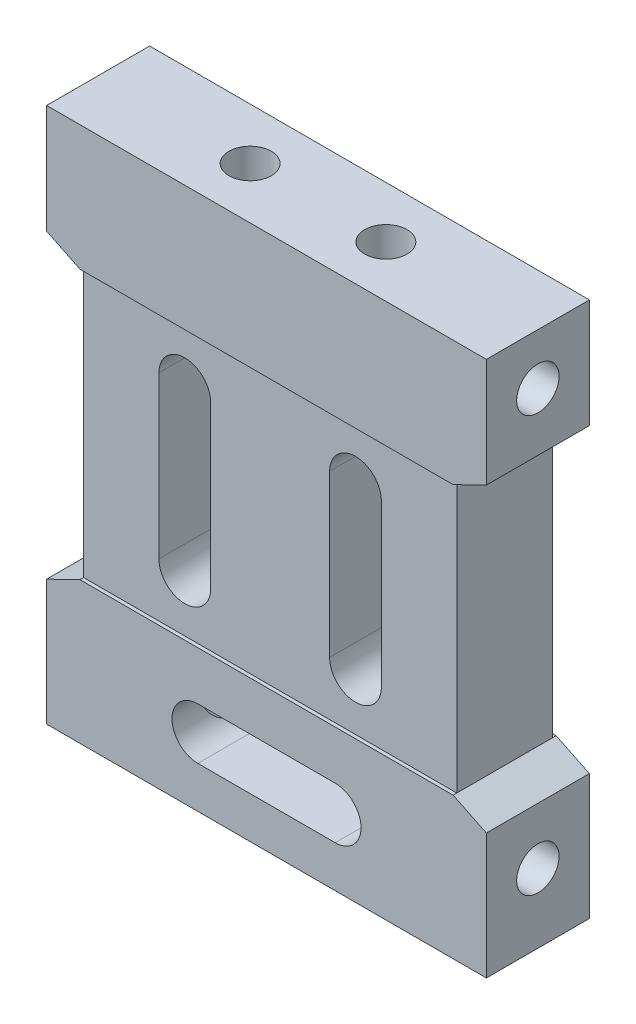
from build123d import *

# Parameters (mm, degrees)
SCHIZZO1_W                         = 25.92
SCHIZZO1_H                         = 31.58
ESTRUSIONE_ESTRUSIONE1_DEPTH       = 6.07
TAGLIO_ESTRUSIONE1_DEPTH           = 22.310340213
SCHIZZO3_W                         = 0.215
SCHIZZO3_H                         = 15.85
TAGLIO_ESTRUSIONE2_DEPTH           = 31.951823856
FORO_FILETTATO_M3X0_5_1_D          = 2.5
FORO_FILETTATO_M3X0_5_1_DEPTH      = 8.5
FORO_FILETTATO_M3X0_5_1_TIP        = 0.751075774
FORO_FILETTATO_M3X0_5_3_AT_2_COUNT = 2
FORO_FILETTATO_M3X0_5_3_AT_2_PITCH = 24.5


with BuildPart() as part:
    # Schizzo1 → Estrusione-Estrusione1 (new body)
    with BuildSketch(Plane.XY):
        Rectangle(SCHIZZO1_W, SCHIZZO1_H)
    extrude(amount=-ESTRUSIONE_ESTRUSIONE1_DEPTH)

    # Schizzo2 → Taglio-Estrusione1 (cut, through all)
    with BuildSketch(Plane.XY):
        Polygon((-11, 8.415), (-12.96, 9.37), (-12.96, -8.39), (-11, -7.435), align=None)
        with BuildLine():
            Line((-6.555, 5.24), (-6.555, -4.26))
            ThreePointArc((-6.555, -4.26), (-5.03, -5.785), (-3.505, -4.26))
            Line((-3.505, -4.26), (-3.505, 5.24))
            ThreePointArc((-3.505, 5.24), (-5.03, 6.765), (-6.555, 5.24))
        make_face()
        with BuildLine():
            ThreePointArc((6.555, -4.26), (5.03, -5.785), (3.505, -4.26))
            Line((3.505, -4.26), (3.505, 5.24))
            ThreePointArc((3.505, 5.24), (5.03, 6.765), (6.555, 5.24))
            Line((6.555, 5.24), (6.555, -4.26))
        make_face()
        Polygon((12.96, -8.39), (12.96, 9.37), (11, 8.415), (11, -7.435), align=None)
        with BuildLine():
            Line((-4.05, -13.34), (4.05, -13.34))
            ThreePointArc((4.05, -13.34), (5.57, -11.82), (4.05, -10.3))
            Line((4.05, -10.3), (-4.05, -10.3))
            ThreePointArc((-4.05, -10.3), (-5.57, -11.82), (-4.05, -13.34))
        make_face()
    extrude(amount=-TAGLIO_ESTRUSIONE1_DEPTH, mode=Mode.SUBTRACT)

    # Schizzo3 → Taglio-Estrusione2 (cut, through all)
    with BuildSketch(Plane.ZY.offset(12.96)):
        with Locations((-5.9625, 0.49)):
            Rectangle(SCHIZZO3_W, SCHIZZO3_H)
        with Locations((-0.1075, 0.49)):
            Rectangle(SCHIZZO3_W, SCHIZZO3_H)
    extrude(amount=-TAGLIO_ESTRUSIONE2_DEPTH, mode=Mode.SUBTRACT)

    # Foro filettato M3x0.5-1
    with Locations(Plane(origin=(0, 15.79, 0), x_dir=(1, 0, 0), z_dir=(0, 1, 0))):
        with Locations((-4, 3.035), (4, 3.035)):
            Hole(FORO_FILETTATO_M3X0_5_1_D / 2, depth=FORO_FILETTATO_M3X0_5_1_DEPTH)
            with Locations((0, 0, -(FORO_FILETTATO_M3X0_5_1_DEPTH + FORO_FILETTATO_M3X0_5_1_TIP / 2))):  # 118° drill point
                Cone(0, FORO_FILETTATO_M3X0_5_1_D / 2, FORO_FILETTATO_M3X0_5_1_TIP, mode=Mode.SUBTRACT)

    # Schizzo8 → Foro filettato M3x0.5-3 (revolve, cut)
    with BuildSketch(Plane(origin=(-12.96, 12.79, -3.035), x_dir=(0, 0, 1), z_dir=(0, 1, 0))):
        Polygon((0, 0), (0, 9.251075774), (1.25, 8.5), (1.25, 0), align=None)
    foro_filettato_m3x0_5_3 = revolve(axis=Axis((-19.31, 12.79, -3.035), (1, 0, 0)), mode=Mode.SUBTRACT)

    # Foro filettato M3x0.5-3 at 2: Foro filettato M3x0.5-3 ×2
    with Locations(*[(0, -i * FORO_FILETTATO_M3X0_5_3_AT_2_PITCH, 0) for i in range(1, FORO_FILETTATO_M3X0_5_3_AT_2_COUNT)]):
        add(foro_filettato_m3x0_5_3, mode=Mode.SUBTRACT)

    # Specchia1: Foro filettato M3x0.5-3 across plane
    add(foro_filettato_m3x0_5_3.mirror(Plane(origin=(0, 0, 0), x_dir=(0, 0, 1), z_dir=(1, 0, 0))), mode=Mode.SUBTRACT)

    # Specchia1 copy 1 sketch → Specchia1 copy 1 (revolve, cut)
    with BuildSketch(Plane(origin=(12.96, -11.71, -3.035), x_dir=(0, 0, 1), z_dir=(0, 1, 0))):
        Polygon((0, 0), (0, -9.251075774), (1.25, -8.5), (1.25, 0), align=None)
    revolve(axis=Axis((19.31, -11.71, -3.035), (1, 0, 0)), mode=Mode.SUBTRACT)


solid = part.part
